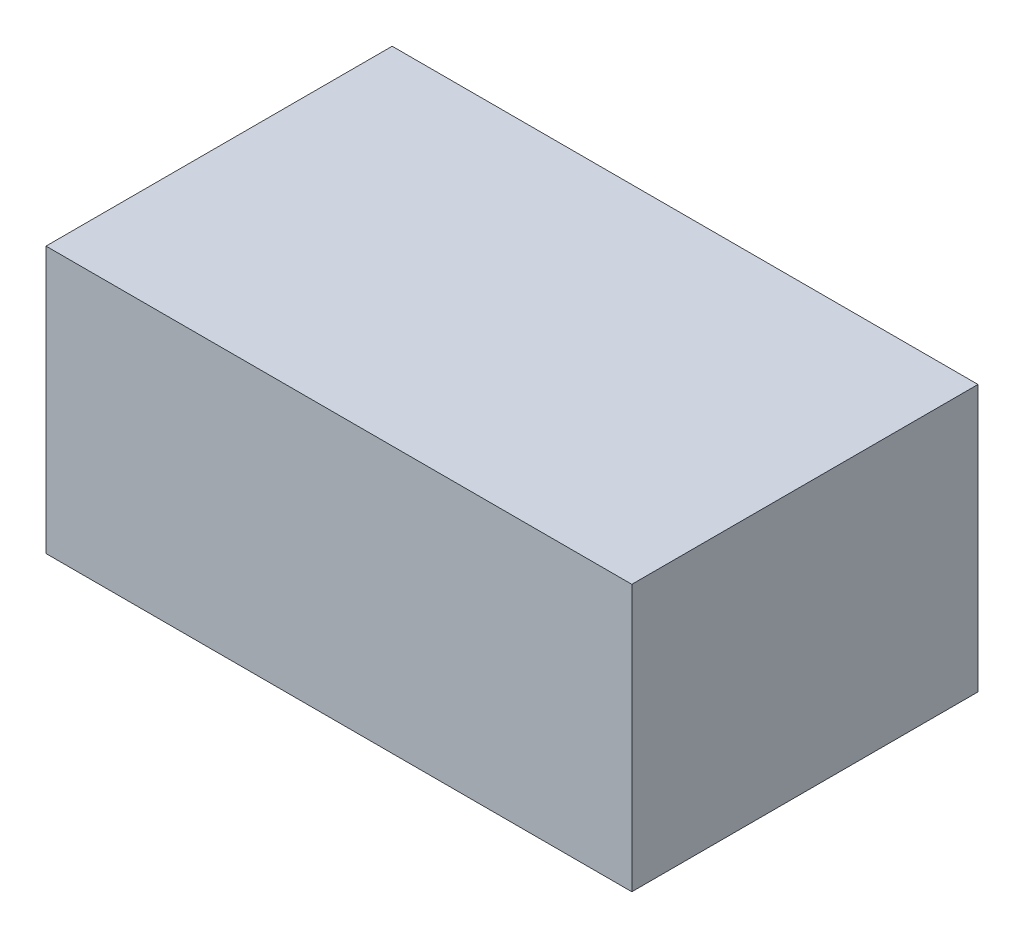
from build123d import *

# Parameters (mm, degrees)
SKETCH2_W           = 27.94
SKETCH2_H           = 16.51
BOSS_EXTRUDE1_DEPTH = 12.7


with BuildPart() as part:
    # Sketch2 → Boss-Extrude1 (new body)
    with BuildSketch(Plane(origin=(0, 0, 0), x_dir=(1, 0, 0), z_dir=(0, 1, 0))):
        Rectangle(SKETCH2_W, SKETCH2_H)
    extrude(amount=BOSS_EXTRUDE1_DEPTH)


solid = part.part
